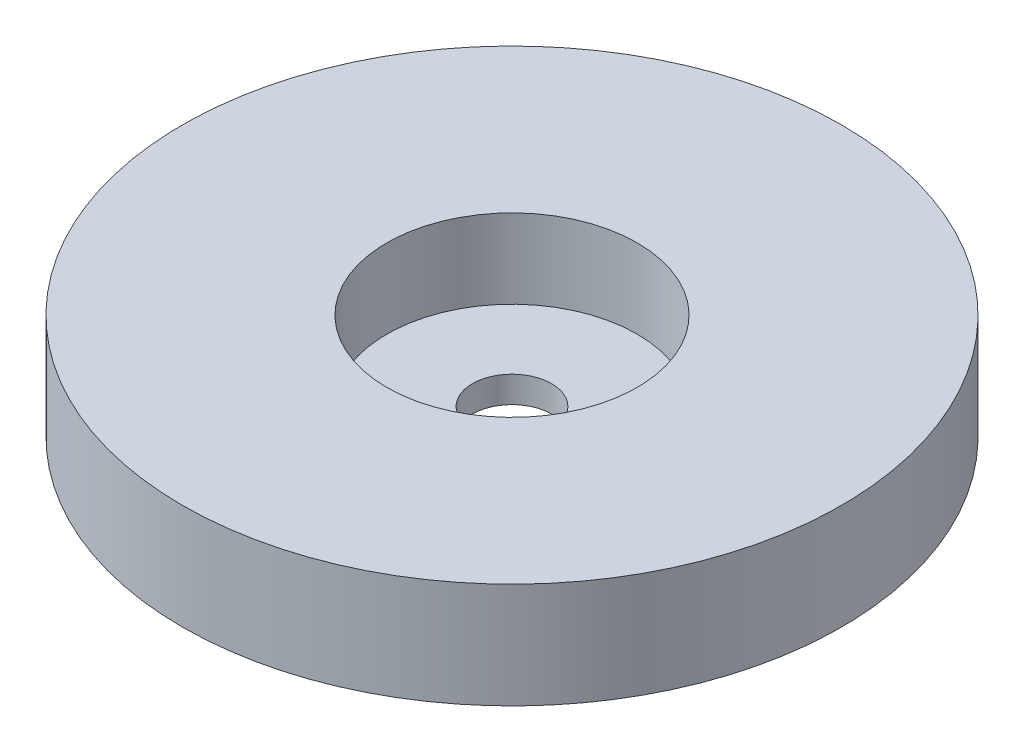
from build123d import *

# Parameters (mm, degrees)
ESQUISSE1_R                  = 25
BOSS_EXTRU_1_DEPTH           = 8
ESQUISSE2_R                  = 9.5
ENL_V_MAT_EXTRU_1_DEPTH      = 6
ENL_V_MAT_EXTRU_2_DEPTH      = 37.249137921
ENL_V_MAT_EXTRU_2_DEPTH_BACK = 37.249137921
ESQUISSE4_R                  = 3


with BuildPart() as part:
    # Esquisse1 → Boss.-Extru.1 (new body)
    with BuildSketch(Plane(origin=(0, 0, 0), x_dir=(1, 0, 0), z_dir=(0, 1, 0))):
        with Locations(Location((0, 0, 0), (0, 0, 270))):
            Circle(ESQUISSE1_R)
    extrude(amount=BOSS_EXTRU_1_DEPTH)

    # Esquisse2 → Enlèv. mat.-Extru.1 (cut)
    with BuildSketch(Plane(origin=(0, 8, 0), x_dir=(1, 0, 0), z_dir=(0, 1, 0))):
        with Locations(Location((0, 0, 0), (0, 0, 270))):
            Circle(ESQUISSE2_R)
    extrude(amount=-ENL_V_MAT_EXTRU_1_DEPTH, mode=Mode.SUBTRACT)

    # Esquisse4 → Enlèv. mat.-Extru.2 (cut, two sides: drawn at the far end of the back side and taken through both)
    with BuildSketch(Plane.XZ.offset(-ENL_V_MAT_EXTRU_2_DEPTH_BACK)):
        with Locations(Location((0, 0, 0), (0, 0, 90))):
            Circle(ESQUISSE4_R)
    extrude(amount=ENL_V_MAT_EXTRU_2_DEPTH + ENL_V_MAT_EXTRU_2_DEPTH_BACK, mode=Mode.SUBTRACT)


solid = part.part
